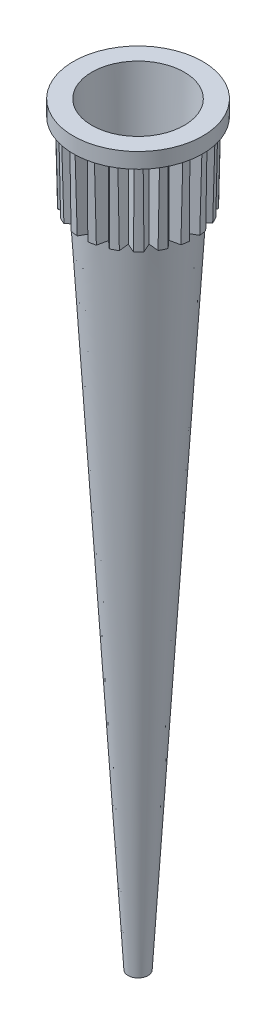
from build123d import *

# Parameters (mm, degrees)
IZIM2_R               = 3
KES_EKSTR_ZYON1_DEPTH = 49
KES_EKSTR_ZYON1_DRAFT = -3
KES_EKSTR_ZYON4_DEPTH = 5


with BuildPart() as part:
    # Çizim1 → Döndür1 (revolve)
    with BuildSketch(Plane.XY, mode=Mode.PRIVATE) as d_nd_r1_sk:
        Polygon((0, 0), (0, 49), (4.2, 49), (4.2, 48), (3.8, 48), (3.7, 43), (3.15, 43), (0.65, 0), align=None)
    revolve(d_nd_r1_sk.sketch.rotate(Axis((0, 0, 0), (0, 1, 0)), 90), axis=Axis((0, 0, 0), (0, 1, 0)))


with BuildPart() as kes_ekstr_zyon1_tool:
    # Çizim2 → Kes-Ekstrüzyon1 (with draft: the straight prism first)
    with BuildSketch(Plane(origin=(0, 49, 0), x_dir=(1, 0, 0), z_dir=(0, 1, 0))):
        Circle(IZIM2_R)
    extrude(amount=-KES_EKSTR_ZYON1_DEPTH)
    # Kes-Ekstrüzyon1: the draft: its side faces are tilted about the plane it starts from
    kes_ekstr_zyon1_sides = [kes_ekstr_zyon1_tool.faces().sort_by_distance(p)[0] for p in [
        (-3, 24.5, 0),
    ]]
    draft(kes_ekstr_zyon1_sides, Plane(origin=(0, 49, 0), x_dir=(1, 0, 0), z_dir=(0, 1, 0)), KES_EKSTR_ZYON1_DRAFT)


with BuildPart() as part_1:
    add(part.part)

    # Kes-Ekstrüzyon1: cut by kes_ekstr_zyon1_tool
    add(kes_ekstr_zyon1_tool.part, mode=Mode.SUBTRACT)

    # Çizim3 → Kes-Ekstrüzyon4 (cut)
    with BuildSketch(Plane.XZ.offset(-43)):
        Polygon((0.08224501, 3.1), (-0.41775499, 3.966025404), (0.58224501, 3.966025404), align=None)
        Polygon((0.815256969, 3.918905719), (1.766313485, 3.609888725), (1.02316866, 2.940758119), align=None)
        Polygon((1.973360244, 3.493070587), (2.782377238, 2.905285335), (1.868831781, 2.498548692), align=None)
        Polygon((2.943191617, 2.730203716), (3.53097687, 1.921186722), (2.536454974, 1.816658258), align=None)
        Polygon((3.629817237, 1.704979831), (3.938834232, 0.753923315), (2.960686631, 0.961835006), align=None)
        Polygon((3.966025404, 0.51775499), (3.966025404, -0.48224501), (3.1, 0.01775499), align=None)
        Polygon((3.918905719, -0.715256969), (3.609888725, -1.666313485), (2.940758119, -0.92316866), align=None)
        Polygon((3.493070587, -1.873360244), (2.905285335, -2.682377238), (2.498548692, -1.768831781), align=None)
        Polygon((2.730203716, -2.843191617), (1.921186722, -3.43097687), (1.816658258, -2.436454974), align=None)
        Polygon((1.704979831, -3.529817237), (0.753923315, -3.838834232), (0.961835006, -2.860686631), align=None)
        Polygon((0.51775499, -3.866025404), (-0.48224501, -3.866025404), (0.01775499, -3), align=None)
        Polygon((-0.715256969, -3.818905719), (-1.666313485, -3.509888725), (-0.92316866, -2.840758119), align=None)
        Polygon((-1.873360244, -3.393070587), (-2.682377238, -2.805285335), (-1.768831781, -2.398548692), align=None)
        Polygon((-2.843191617, -2.630203716), (-3.43097687, -1.821186722), (-2.436454974, -1.716658258), align=None)
        Polygon((-3.529817237, -1.604979831), (-3.838834232, -0.653923315), (-2.860686631, -0.861835006), align=None)
        Polygon((-3.866025404, -0.41775499), (-3.866025404, 0.58224501), (-3, 0.08224501), align=None)
        Polygon((-3.818905719, 0.815256969), (-3.509888725, 1.766313485), (-2.840758119, 1.02316866), align=None)
        Polygon((-3.393070587, 1.973360244), (-2.805285335, 2.782377238), (-2.398548692, 1.868831781), align=None)
        Polygon((-2.630203716, 2.943191617), (-1.821186722, 3.53097687), (-1.716658258, 2.536454974), align=None)
        Polygon((-1.604979831, 3.629817237), (-0.653923315, 3.938834232), (-0.861835006, 2.960686631), align=None)
    extrude(amount=-KES_EKSTR_ZYON4_DEPTH, mode=Mode.SUBTRACT)


solid = part_1.part
